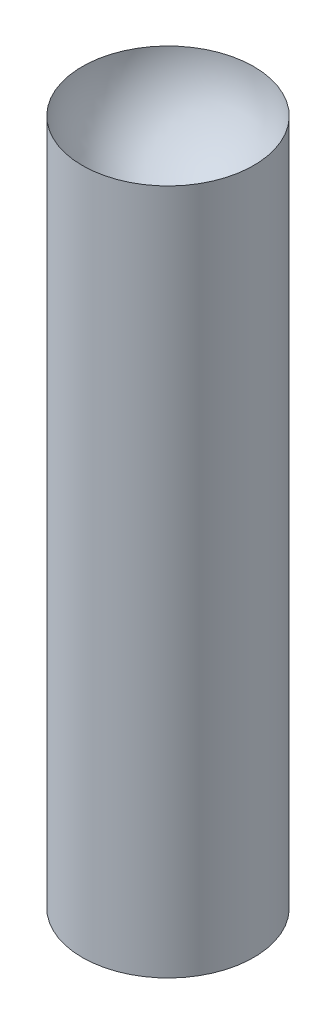
from build123d import *

# Parameters (mm, degrees)
SKETCH1_R           = 12.7
BOSS_EXTRUDE1_DEPTH = 101.6


with BuildPart() as part:
    # Sketch1 → Boss-Extrude1 (new body)
    with BuildSketch(Plane(origin=(0, 0, 0), x_dir=(1, 0, 0), z_dir=(0, 1, 0))):
        with Locations(Location((0, 0, 0), (0, 0, 270))):
            Circle(SKETCH1_R)
    extrude(amount=BOSS_EXTRUDE1_DEPTH)

    # Sketch2 → Cut-Revolve1 (revolve, cut)
    with BuildSketch(Plane(origin=(0, 101.6, 0), x_dir=(1, 0, 0), z_dir=(0, 1, 0))):
        with BuildLine():
            Line((0, 12.7), (0, -12.7))
            ThreePointArc((0, -12.7), (12.7, 0), (0, 12.7))
        make_face()
    revolve(axis=Axis((0, 101.6, -12.7), (0, 0, 1)), mode=Mode.SUBTRACT)

    # Sketch3 → Cut-Revolve2 (revolve, cut)
    with BuildSketch(Plane(origin=(0, 0, 0), x_dir=(-1, 0, 0), z_dir=(0, -1, 0))):
        with BuildLine():
            Line((0, -10.16), (0, 10.16))
            ThreePointArc((0, 10.16), (-10.16, 0), (0, -10.16))
        make_face()
    revolve(axis=Axis((0, 0, 10.16), (0, 0, -1)), mode=Mode.SUBTRACT)


solid = part.part
